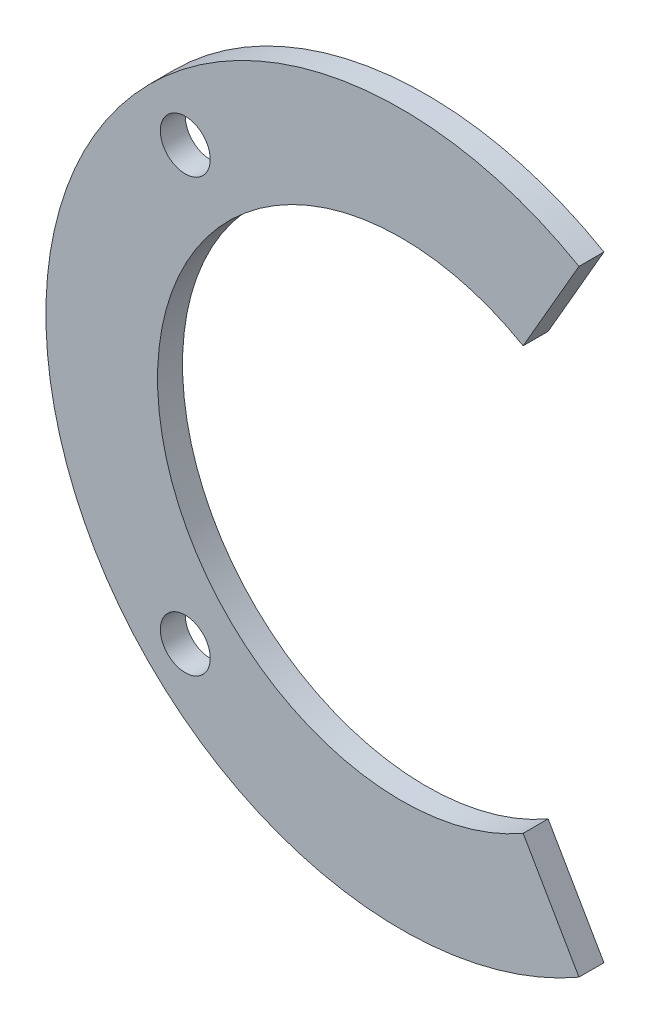
from build123d import *

# Parameters (mm, degrees)
SKETCH2_R           = 3.175
BOSS_EXTRUDE2_DEPTH = 3.175


with BuildPart() as part:
    # Sketch2 → Boss-Extrude2 (new body)
    with BuildSketch(Plane.XY):
        with BuildLine():
            Line((22.6, 39.144348251), (15.500000012, 26.846787538))
            ThreePointArc((15.500000012, 26.846787538), (-31.000000024, 0), (15.500000012, -26.846787538))
            Line((15.500000012, -26.846787538), (22.6, -39.144348251))
            ThreePointArc((22.6, -39.144348251), (-45.2, 0), (22.6, 39.144348251))
        make_face()
        with Locations((-27.471098449, -27.471098449)):
            Circle(SKETCH2_R, mode=Mode.SUBTRACT)
        with Locations((-27.471098449, 27.471098449)):
            Circle(SKETCH2_R, mode=Mode.SUBTRACT)
    extrude(amount=BOSS_EXTRUDE2_DEPTH)


solid = part.part
